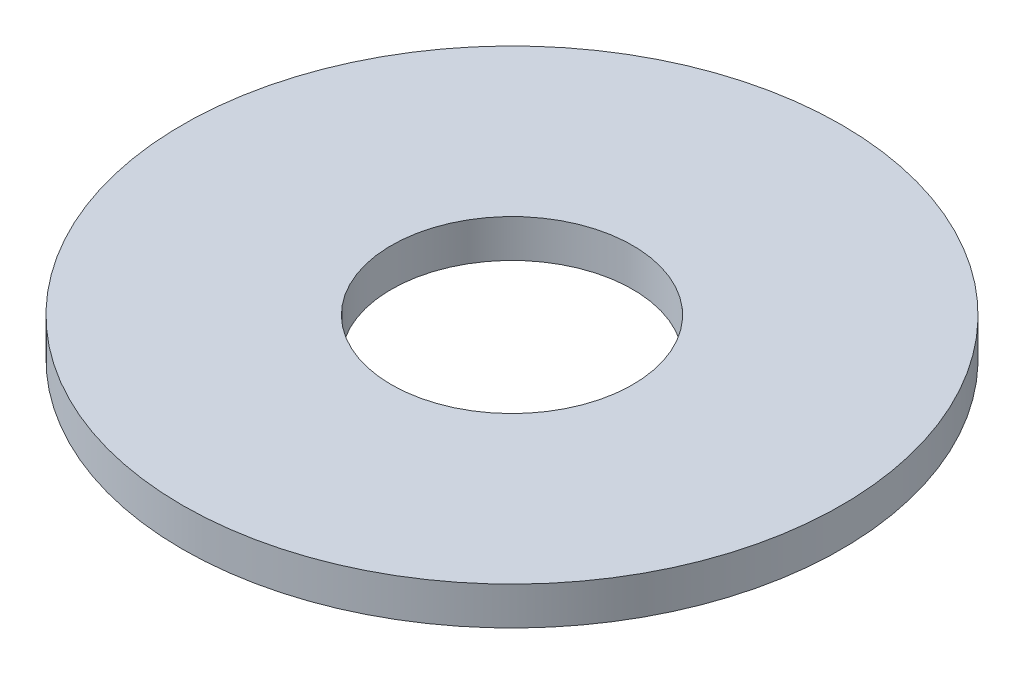
from build123d import *

# Parameters (mm, degrees)
ESBO_O1_R                = 13
ESBO_O1_R_2              = 4.76
RESSALTO_EXTRUS_O1_DEPTH = 0.75


with BuildPart() as part:
    # Esboço1 → Ressalto-extrusão1 (new, symmetric)
    with BuildSketch(Plane(origin=(0, 0, 0), x_dir=(1, 0, 0), z_dir=(0, 1, 0))):
        with Locations(Location((0, 0, 0), (0, 0, 270))):
            Circle(ESBO_O1_R)
        with Locations(Location((0, 0, 0), (0, 0, 270))):
            Circle(ESBO_O1_R_2, mode=Mode.SUBTRACT)
    extrude(amount=RESSALTO_EXTRUS_O1_DEPTH, both=True)


solid = part.part
